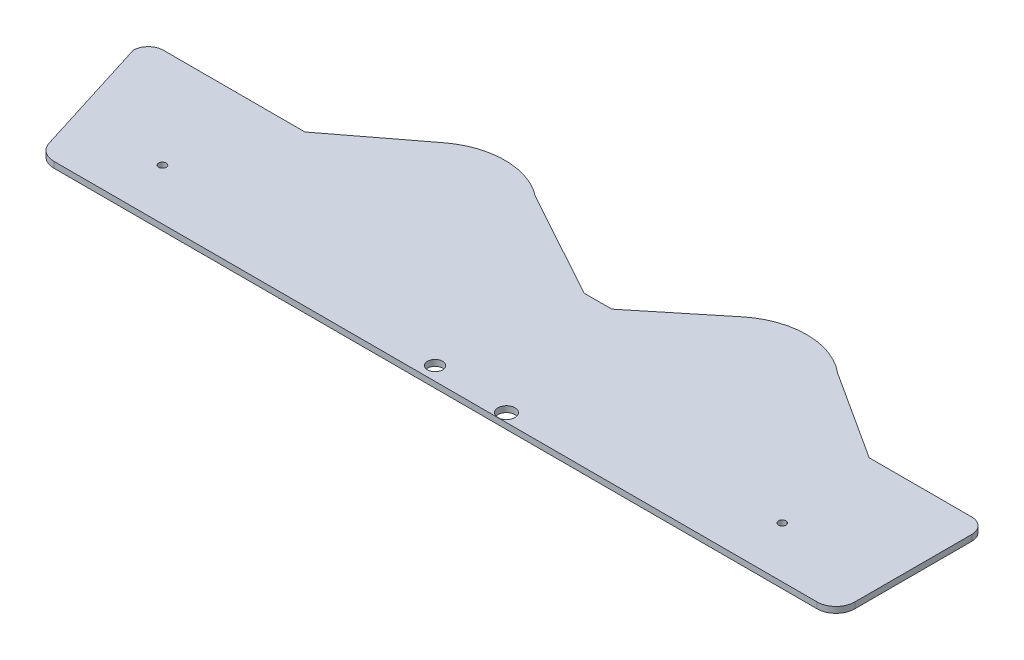
from build123d import *

# Parameters (mm, degrees)
SKETCH1_R           = 3.716178426
SKETCH1_R_2         = 4.313560469
SKETCH1_R_3         = 4.511205791
BOSS_EXTRUDE1_DEPTH = 3.175
SKETCH2_W           = 597.466303312
SKETCH2_H           = 60.972543052
CUT_EXTRUDE1_DEPTH  = 70
FILLET1_R           = 10
FILLET2_R           = 10
SKETCH3_R           = 3.990837639
CUT_EXTRUDE2_DEPTH  = 10
SKETCH4_R           = 2
CUT_EXTRUDE3_DEPTH  = 470.13785887
SKETCH5_R           = 2
CUT_EXTRUDE4_DEPTH  = 10
SKETCH6_R           = 40
BOSS_EXTRUDE2_DEPTH = 3.175
BOSS_EXTRUDE3_DEPTH = 3.175
SKETCH9_R           = 40
BOSS_EXTRUDE4_DEPTH = 3.175
BOSS_EXTRUDE6_DEPTH = 3.175


with BuildPart() as part:
    # Sketch1 → Boss-Extrude1 (new body)
    with BuildSketch(Plane(origin=(0, 0, 0), x_dir=(1, 0, 0), z_dir=(0, 1, 0))):
        with BuildLine():
            ThreePointArc((8, 150), (2.343145751, 147.656854249), (0, 142))
            Line((0, 142), (42, 8))
            ThreePointArc((42, 8), (44.343145751, 2.343145751), (50, 0))
            Line((50, 0), (436.5, 0))
            ThreePointArc((436.5, 0), (442.156854249, 2.343145751), (444.5, 8))
            Line((444.5, 8), (444.5, 142))
            ThreePointArc((444.5, 142), (442.156854249, 147.656854249), (436.5, 150))
            Line((436.5, 150), (8, 150))
        make_face()
        with Locations(Location((146.269370224, 139.84039861, 0), (0, 0, 270))):
            Circle(SKETCH1_R, mode=Mode.SUBTRACT)
        with Locations(Location((307.606475607, 140.710564477, 0), (0, 0, 270))):
            Circle(SKETCH1_R_2, mode=Mode.SUBTRACT)
        with Locations(Location((265.281257274, 74.563866981, 0), (0, 0, 270))):
            Circle(SKETCH1_R_3, mode=Mode.SUBTRACT)
    extrude(amount=BOSS_EXTRUDE1_DEPTH)

    # Sketch2 → Cut-Extrude1 (cut)
    with BuildSketch(Plane.XY):
        with Locations((220.1785332, 7.544358636)):
            Rectangle(SKETCH2_W, SKETCH2_H)
    extrude(amount=-CUT_EXTRUDE1_DEPTH, mode=Mode.SUBTRACT)

    # Fillet1
    fillet1_edges = [part.edges().sort_by_distance(p)[0] for p in [
        (22.567164179, 1.5875, -70),
    ]]
    fillet(fillet1_edges, radius=FILLET1_R)

    # Fillet2
    fillet2_edges = [part.edges().sort_by_distance(p)[0] for p in [
        (444.5, 1.5875, -70),
    ]]
    fillet(fillet2_edges, radius=FILLET2_R)

    # Sketch3 → Cut-Extrude2 (cut)
    with BuildSketch(Plane(origin=(0, 3.175, 0), x_dir=(1, 0, 0), z_dir=(0, 1, 0))):
        with Locations(Location((224.75, 77.255, 0), (0, 0, 270))):
            Circle(SKETCH3_R)
    extrude(amount=-CUT_EXTRUDE2_DEPTH, mode=Mode.SUBTRACT)

    # Sketch4 → Cut-Extrude3 (cut, through all)
    with BuildSketch(Plane(origin=(0, 3.175, 0), x_dir=(1, 0, 0), z_dir=(0, 1, 0))):
        with Locations(Location((60.5, 97, 0), (0, 0, 270))):
            Circle(SKETCH4_R)
    extrude(amount=-CUT_EXTRUDE3_DEPTH, mode=Mode.SUBTRACT)

    # Sketch5 → Cut-Extrude4 (cut)
    with BuildSketch(Plane(origin=(0, 3.175, 0), x_dir=(1, 0, 0), z_dir=(0, 1, 0))):
        with Locations(Location((389, 97, 0), (0, 0, 270))):
            Circle(SKETCH5_R)
    extrude(amount=-CUT_EXTRUDE4_DEPTH, mode=Mode.SUBTRACT)

    # Sketch6 → Boss-Extrude2 (add)
    with BuildSketch(Plane(origin=(0, 0, 0), x_dir=(1, 0, 0), z_dir=(0, 1, 0))):
        with Locations((149, 150.04039861)):
            Circle(SKETCH6_R)
    extrude(amount=BOSS_EXTRUDE2_DEPTH)

    # Sketch7 → Boss-Extrude3 (add)
    with BuildSketch(Plane(origin=(0, 0, 0), x_dir=(1, 0, 0), z_dir=(0, 1, 0))):
        Polygon((124.164543783, 181.396420591), (82.702881078, 149.750534228), (231.468946681, 149.750534228), (173.835456217, 181.396420591), align=None)
    extrude(amount=BOSS_EXTRUDE3_DEPTH)

    # Sketch9 → Boss-Extrude4 (add)
    with BuildSketch(Plane(origin=(0, 0, 0), x_dir=(1, 0, 0), z_dir=(0, 1, 0))):
        with BuildLine():
            ThreePointArc((269, 150), (272.870833001, 167.166341835), (283.734164599, 181.010281545))
            Line((283.734164599, 181.010281545), (245.673378314, 150))
            Line((245.673378314, 150), (269, 150))
        make_face()
        with Locations((309, 150)):
            Circle(SKETCH9_R)
    extrude(amount=BOSS_EXTRUDE4_DEPTH)

    # Sketch12 → Boss-Extrude6 (add)
    with BuildSketch(Plane(origin=(0, 0, 0), x_dir=(1, 0, 0), z_dir=(0, 1, 0))):
        Polygon((326.166341835, 186.129166999), (382.106475607, 150), (340.398839744, 150), align=None)
    extrude(amount=BOSS_EXTRUDE6_DEPTH)


solid = part.part
